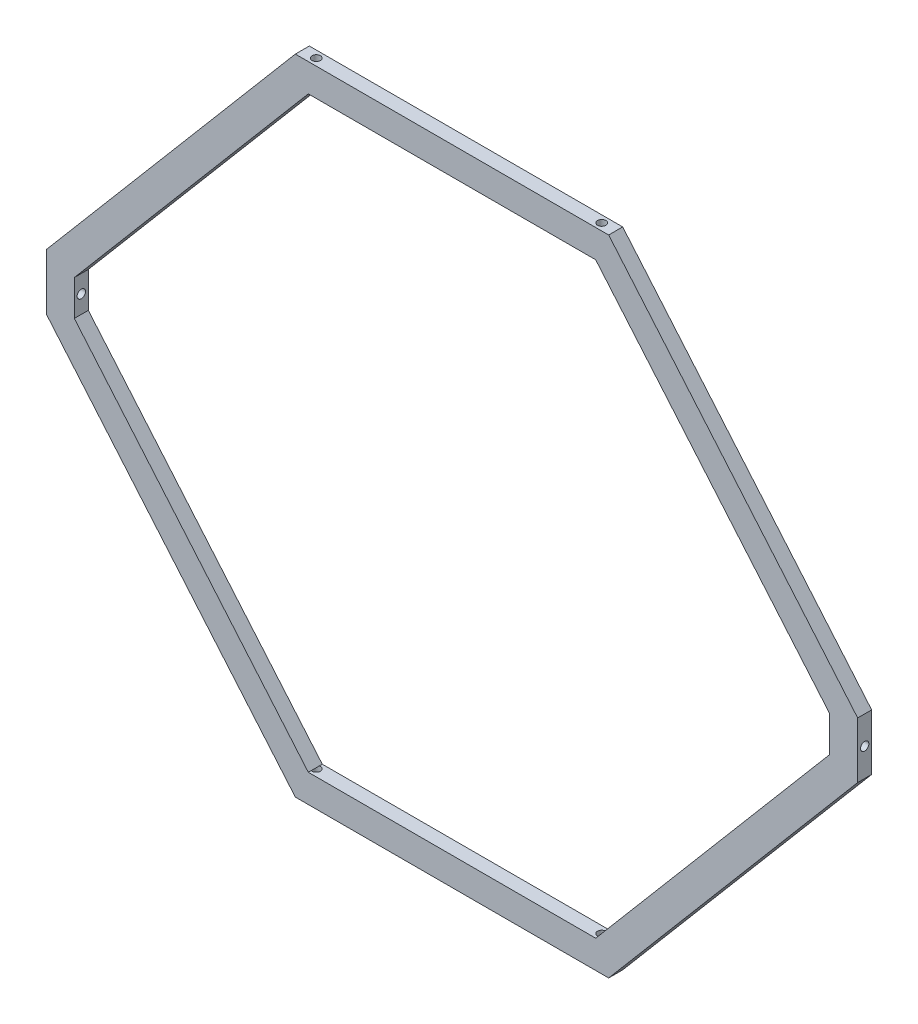
from build123d import *

# Parameters (mm, degrees)
EXTRUDE_1_DEPTH     = 5
SKETCH_2_R          = 1.5
CUT_EXTRUDE_1_DEPTH = 10
CUT_EXTRUDE_START   = -10
SKETCH_3_R          = 1.5
CUT_EXTRUDE_2_DEPTH = 10
SKETCH_4_R          = 1.5
CUT_EXTRUDE_3_DEPTH = 10
SKETCH_5_R          = 1.5
CUT_EXTRUDE_4_DEPTH = 10


with BuildPart() as part:
    # 草图1 → 凸台-拉伸1 (new body)
    with BuildSketch(Plane.XY):
        Polygon((0, 0), (112, 0), (201, -105), (201, -115), (201, -125), (112, -230), (56, -230), (0, -230), (-89, -125), (-89, -115), (-89, -105), align=None)
        Polygon((4.632806625, -10), (107.367193375, -10), (191, -108.667917928), (191, -115), (191, -121.332082072), (107.367193375, -220), (56, -220), (4.632806625, -220), (-79, -121.332082072), (-79, -115), (-79, -108.667917928), align=None, mode=Mode.SUBTRACT)
    extrude(amount=EXTRUDE_1_DEPTH)

    # 草图2 → 切除-拉伸1 (cut)
    with BuildSketch(Plane(origin=(0, 0, 0), x_dir=(1, 0, 0), z_dir=(0, 1, 0))):
        with Locations(Location((5, -2.5, 0), (0, 0, 270))):
            Circle(SKETCH_2_R)
        with Locations(Location((107, -2.5, 0), (0, 0, 270))):
            Circle(SKETCH_2_R)
    extrude(amount=-CUT_EXTRUDE_1_DEPTH, mode=Mode.SUBTRACT)

    # 草图3 → 切除-拉伸2 (cut)
    with BuildSketch(Plane.XZ.offset(230).offset(CUT_EXTRUDE_START)):
        with Locations(Location((5, 2.5, 0), (0, 0, 90))):
            Circle(SKETCH_3_R)
        with Locations(Location((107, 2.5, 0), (0, 0, 90))):
            Circle(SKETCH_3_R)
    extrude(amount=CUT_EXTRUDE_2_DEPTH, mode=Mode.SUBTRACT)

    # 草图4 → 切除-拉伸3 (cut)
    with BuildSketch(Plane.ZY.offset(89)):
        with Locations((2.5, -115)):
            Circle(SKETCH_4_R)
    extrude(amount=-CUT_EXTRUDE_3_DEPTH, mode=Mode.SUBTRACT)

    # 草图5 → 切除-拉伸4 (cut)
    with BuildSketch(Plane(origin=(201, 0, 0), x_dir=(0, 0, -1), z_dir=(1, 0, 0)).offset(CUT_EXTRUDE_START)):
        with Locations(Location((-2.5, -115, 0), (0, 0, 180))):
            Circle(SKETCH_5_R)
    extrude(amount=CUT_EXTRUDE_4_DEPTH, mode=Mode.SUBTRACT)


solid = part.part
